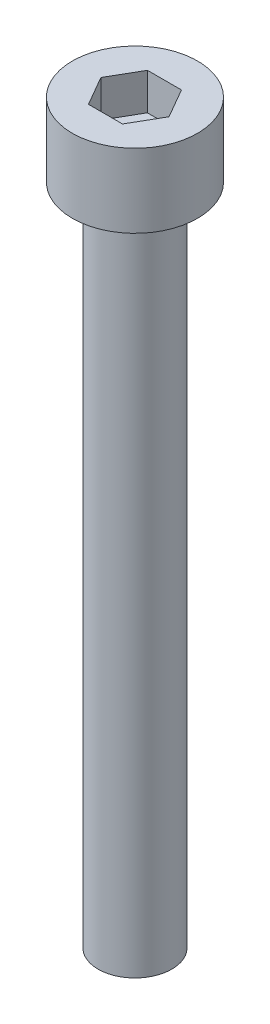
from build123d import *

# Parameters (mm, degrees)
CUT_EXTRUDE1_DEPTH = 2.5


with BuildPart() as part:
    # Sketch1 → Revolve1 (revolve)
    with BuildSketch(Plane.XY, mode=Mode.PRIVATE) as revolve1_sk:
        Polygon((0, -45), (2.5, -45), (2.5, 0), (4.25, 0), (4.25, 5), (0, 5), align=None)
    revolve(revolve1_sk.sketch.rotate(Axis((0, 61.691642626, 0), (0, -1, 0)), 90), axis=Axis((0, 61.691642626, 0), (0, -1, 0)))

    # Sketch2 → Cut-Extrude1 (cut)
    with BuildSketch(Plane(origin=(0, 5, 0), x_dir=(-1, 0, 0), z_dir=(0, 1, 0))):
        Polygon((-1.154700538, -2), (1.154700538, -2), (2.309401077, 0), (1.154700538, 2), (-1.154700538, 2), (-2.309401077, 0), align=None)
    extrude(amount=-CUT_EXTRUDE1_DEPTH, mode=Mode.SUBTRACT)


solid = part.part
